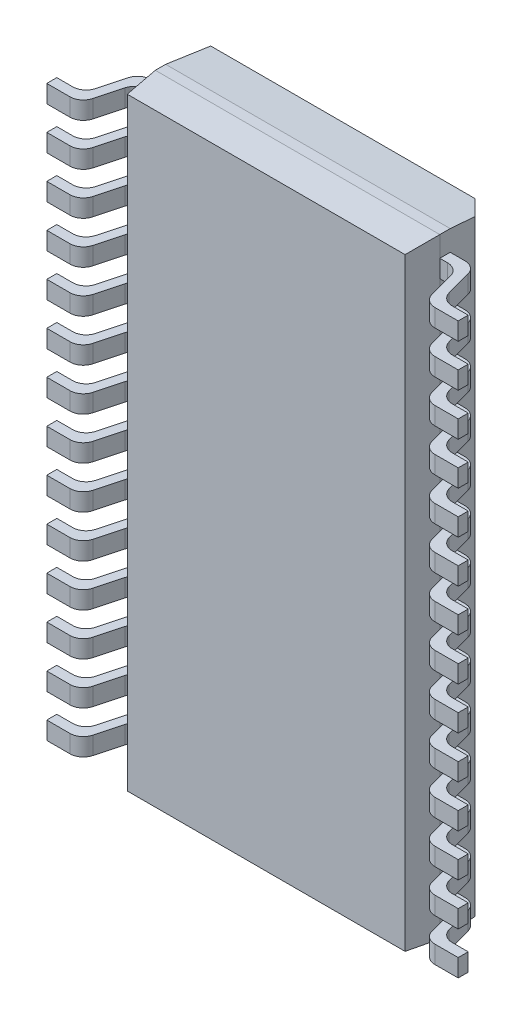
from build123d import *

# Parameters (mm, degrees)
BOSS_EXTRUDE1_DEPTH = 0.53
LPATTERN1_COUNT     = 14
LPATTERN1_PITCH     = 1.27
SKETCH3_W           = 8.52
SKETCH3_H           = 18.27
BOSS_EXTRUDE2_DEPTH = 1.25
SKETCH6_W           = 8.52
SKETCH6_H           = 18.27
BOSS_EXTRUDE3_DEPTH = 1.25
CHAMFER1_SIZE       = 0.5
SKETCH7_R           = 0.6
CUT_EXTRUDE1_DEPTH  = 0.2
CUT_EXTRUDE2_DEPTH  = 22.221478835
CUT_EXTRUDE3_DEPTH  = 21.594895779


with BuildPart() as part:
    # Sketch1 → Boss-Extrude1 (new body)
    with BuildSketch(Plane(origin=(0, 0, 0), x_dir=(1, 0, 0), z_dir=(0, 1, 0))):
        with BuildLine():
            Line((-0.420962579, 0.111853592), (-0.623814918, -0.645201644))
            ThreePointArc((-0.623814918, -0.645201644), (-0.766680677, -0.859015362), (-1.010185249, -0.941674026))
            Line((-1.010185249, -0.941674026), (-1.704730017, -0.941674026))
            Line((-1.704730017, -0.941674026), (-1.704730017, -0.641674026))
            Line((-1.704730017, -0.641674026), (-1.226071713, -0.641674026))
            ThreePointArc((-1.226071713, -0.641674026), (-0.982567142, -0.559015362), (-0.839701383, -0.345201644))
            Line((-0.839701383, -0.345201644), (-0.634169552, 0.421853592))
            ThreePointArc((-0.634169552, 0.421853592), (-0.491303793, 0.63566731), (-0.247799221, 0.718325974))
            Line((-0.247799221, 0.718325974), (0.195269983, 0.718325974))
            Line((0.195269983, 0.718325974), (0.195269983, 0.408325974))
            Line((0.195269983, 0.408325974), (-0.034592249, 0.408325974))
            ThreePointArc((-0.034592249, 0.408325974), (-0.27809682, 0.32566731), (-0.420962579, 0.111853592))
        make_face()
    extrude(amount=BOSS_EXTRUDE1_DEPTH)


with BuildPart() as lpattern1_1:
    # LPattern1: pattern copy
    add(part.part.moved(Location(Vector(0, 1, 0) * (1 * LPATTERN1_PITCH))))


with BuildPart() as lpattern1_2:
    # LPattern1: pattern copy
    add(part.part.moved(Location(Vector(0, 1, 0) * (2 * LPATTERN1_PITCH))))


with BuildPart() as lpattern1_3:
    # LPattern1: pattern copy
    add(part.part.moved(Location(Vector(0, 1, 0) * (3 * LPATTERN1_PITCH))))


with BuildPart() as lpattern1_4:
    # LPattern1: pattern copy
    add(part.part.moved(Location(Vector(0, 1, 0) * (4 * LPATTERN1_PITCH))))


with BuildPart() as lpattern1_5:
    # LPattern1: pattern copy
    add(part.part.moved(Location(Vector(0, 1, 0) * (5 * LPATTERN1_PITCH))))


with BuildPart() as lpattern1_6:
    # LPattern1: pattern copy
    add(part.part.moved(Location(Vector(0, 1, 0) * (6 * LPATTERN1_PITCH))))


with BuildPart() as lpattern1_7:
    # LPattern1: pattern copy
    add(part.part.moved(Location(Vector(0, 1, 0) * (7 * LPATTERN1_PITCH))))


with BuildPart() as lpattern1_8:
    # LPattern1: pattern copy
    add(part.part.moved(Location(Vector(0, 1, 0) * (8 * LPATTERN1_PITCH))))


with BuildPart() as lpattern1_9:
    # LPattern1: pattern copy
    add(part.part.moved(Location(Vector(0, 1, 0) * (9 * LPATTERN1_PITCH))))


with BuildPart() as lpattern1_10:
    # LPattern1: pattern copy
    add(part.part.moved(Location(Vector(0, 1, 0) * (10 * LPATTERN1_PITCH))))


with BuildPart() as lpattern1_11:
    # LPattern1: pattern copy
    add(part.part.moved(Location(Vector(0, 1, 0) * (11 * LPATTERN1_PITCH))))


with BuildPart() as lpattern1_12:
    # LPattern1: pattern copy
    add(part.part.moved(Location(Vector(0, 1, 0) * (12 * LPATTERN1_PITCH))))


with BuildPart() as lpattern1_13:
    # LPattern1: pattern copy
    add(part.part.moved(Location(Vector(0, 1, 0) * (13 * LPATTERN1_PITCH))))


with BuildPart() as body_15:
    # Mirror1: mirrored copy
    add(part.part.mirror(Plane(origin=(4.455269983, 0, 0), x_dir=(0, 0, 1), z_dir=(1, 0, 0))))


with BuildPart() as body_16:
    # Mirror1 2: mirrored copy
    add(lpattern1_1.part.mirror(Plane(origin=(4.455269983, 0, 0), x_dir=(0, 0, 1), z_dir=(1, 0, 0))))


with BuildPart() as body_17:
    # Mirror1 3: mirrored copy
    add(lpattern1_2.part.mirror(Plane(origin=(4.455269983, 0, 0), x_dir=(0, 0, 1), z_dir=(1, 0, 0))))


with BuildPart() as body_18:
    # Mirror1 4: mirrored copy
    add(lpattern1_3.part.mirror(Plane(origin=(4.455269983, 0, 0), x_dir=(0, 0, 1), z_dir=(1, 0, 0))))


with BuildPart() as body_19:
    # Mirror1 5: mirrored copy
    add(lpattern1_4.part.mirror(Plane(origin=(4.455269983, 0, 0), x_dir=(0, 0, 1), z_dir=(1, 0, 0))))


with BuildPart() as body_20:
    # Mirror1 6: mirrored copy
    add(lpattern1_5.part.mirror(Plane(origin=(4.455269983, 0, 0), x_dir=(0, 0, 1), z_dir=(1, 0, 0))))


with BuildPart() as body_21:
    # Mirror1 7: mirrored copy
    add(lpattern1_6.part.mirror(Plane(origin=(4.455269983, 0, 0), x_dir=(0, 0, 1), z_dir=(1, 0, 0))))


with BuildPart() as body_22:
    # Mirror1 8: mirrored copy
    add(lpattern1_7.part.mirror(Plane(origin=(4.455269983, 0, 0), x_dir=(0, 0, 1), z_dir=(1, 0, 0))))


with BuildPart() as body_23:
    # Mirror1 9: mirrored copy
    add(lpattern1_8.part.mirror(Plane(origin=(4.455269983, 0, 0), x_dir=(0, 0, 1), z_dir=(1, 0, 0))))


with BuildPart() as body_24:
    # Mirror1 10: mirrored copy
    add(lpattern1_9.part.mirror(Plane(origin=(4.455269983, 0, 0), x_dir=(0, 0, 1), z_dir=(1, 0, 0))))


with BuildPart() as body_25:
    # Mirror1 11: mirrored copy
    add(lpattern1_10.part.mirror(Plane(origin=(4.455269983, 0, 0), x_dir=(0, 0, 1), z_dir=(1, 0, 0))))


with BuildPart() as body_26:
    # Mirror1 12: mirrored copy
    add(lpattern1_11.part.mirror(Plane(origin=(4.455269983, 0, 0), x_dir=(0, 0, 1), z_dir=(1, 0, 0))))


with BuildPart() as body_27:
    # Mirror1 13: mirrored copy
    add(lpattern1_12.part.mirror(Plane(origin=(4.455269983, 0, 0), x_dir=(0, 0, 1), z_dir=(1, 0, 0))))


with BuildPart() as body_28:
    # Mirror1 14: mirrored copy
    add(lpattern1_13.part.mirror(Plane(origin=(4.455269983, 0, 0), x_dir=(0, 0, 1), z_dir=(1, 0, 0))))


with BuildPart() as part_1:
    add(part.part)

    add(lpattern1_1.part)  # Boss-Extrude2 merges LPattern1_1

    add(lpattern1_2.part)  # Boss-Extrude2 merges LPattern1_2

    add(lpattern1_3.part)  # Boss-Extrude2 merges LPattern1_3

    add(lpattern1_4.part)  # Boss-Extrude2 merges LPattern1_4

    add(lpattern1_5.part)  # Boss-Extrude2 merges LPattern1_5

    add(lpattern1_6.part)  # Boss-Extrude2 merges LPattern1_6

    add(lpattern1_7.part)  # Boss-Extrude2 merges LPattern1_7

    add(lpattern1_8.part)  # Boss-Extrude2 merges LPattern1_8

    add(lpattern1_9.part)  # Boss-Extrude2 merges LPattern1_9

    add(lpattern1_10.part)  # Boss-Extrude2 merges LPattern1_10

    add(lpattern1_11.part)  # Boss-Extrude2 merges LPattern1_11

    add(lpattern1_12.part)  # Boss-Extrude2 merges LPattern1_12

    add(lpattern1_13.part)  # Boss-Extrude2 merges LPattern1_13

    add(body_15.part)  # Boss-Extrude2 merges body 15

    add(body_16.part)  # Boss-Extrude2 merges body 16

    add(body_17.part)  # Boss-Extrude2 merges body 17

    add(body_18.part)  # Boss-Extrude2 merges body 18

    add(body_19.part)  # Boss-Extrude2 merges body 19

    add(body_20.part)  # Boss-Extrude2 merges body 20

    add(body_21.part)  # Boss-Extrude2 merges body 21

    add(body_22.part)  # Boss-Extrude2 merges body 22

    add(body_23.part)  # Boss-Extrude2 merges body 23

    add(body_24.part)  # Boss-Extrude2 merges body 24

    add(body_25.part)  # Boss-Extrude2 merges body 25

    add(body_26.part)  # Boss-Extrude2 merges body 26

    add(body_27.part)  # Boss-Extrude2 merges body 27

    add(body_28.part)  # Boss-Extrude2 merges body 28
    # Sketch3 → Boss-Extrude2 (add)
    with BuildSketch(Plane(origin=(0, 0, -0.718325974), x_dir=(-1, 0, 0), z_dir=(0, 0, -1))):
        with Locations((-4.455269983, 8.52)):
            Rectangle(SKETCH3_W, SKETCH3_H)
    extrude(amount=-BOSS_EXTRUDE2_DEPTH)

    # Sketch6 → Boss-Extrude3 (add)
    with BuildSketch(Plane(origin=(0, 0, -0.718325974), x_dir=(-1, 0, 0), z_dir=(0, 0, -1))):
        with Locations((-4.455269983, 8.52)):
            Rectangle(SKETCH6_W, SKETCH6_H)
    extrude(amount=BOSS_EXTRUDE3_DEPTH)

    # Chamfer1
    chamfer1_edges = [part_1.edges().sort_by_distance(p)[0] for p in [
        (8.715269983, 8.52, -1.968325974),
    ]]
    chamfer(chamfer1_edges, length=CHAMFER1_SIZE)

    # Sketch7 → Cut-Extrude1 (cut)
    with BuildSketch(Plane(origin=(0, 0, -1.968325974), x_dir=(-1, 0, 0), z_dir=(0, 0, -1))):
        with Locations((-7.415269983, 16.855)):
            Circle(SKETCH7_R)
    extrude(amount=-CUT_EXTRUDE1_DEPTH, mode=Mode.SUBTRACT)

    # Sketch8 → Cut-Extrude2 (cut, through all)
    with BuildSketch(Plane.XZ.offset(0.615)):
        Polygon((0.295269983, 0.531674026), (0.195269983, -0.408325974), (0.195269983, 0.531674026), align=None)
        Polygon((0.195269983, -0.718325974), (0.195269983, -1.968325974), (0.295269983, -1.968325974), align=None)
        Polygon((8.715269983, -0.408325974), (8.715269983, 0.531674026), (8.615269983, 0.531674026), align=None)
    extrude(amount=-CUT_EXTRUDE2_DEPTH, mode=Mode.SUBTRACT)

    # Sketch9 → Cut-Extrude3 (cut, through all)
    with BuildSketch(Plane.ZY.offset(-0.195269983)):
        Polygon((-0.718325974, -0.615), (-1.968325974, -0.515), (-1.968325974, -0.615), align=None)
        Polygon((-0.408325974, -0.615), (0.531674026, -0.615), (0.531674026, -0.515), align=None)
        Polygon((-0.718325974, 17.655), (-1.968325974, 17.655), (-1.968325974, 17.555), align=None)
        Polygon((-0.408325974, 17.655), (0.531674026, 17.655), (0.531674026, 17.555), align=None)
    extrude(amount=-CUT_EXTRUDE3_DEPTH, mode=Mode.SUBTRACT)


solid = part_1.part
